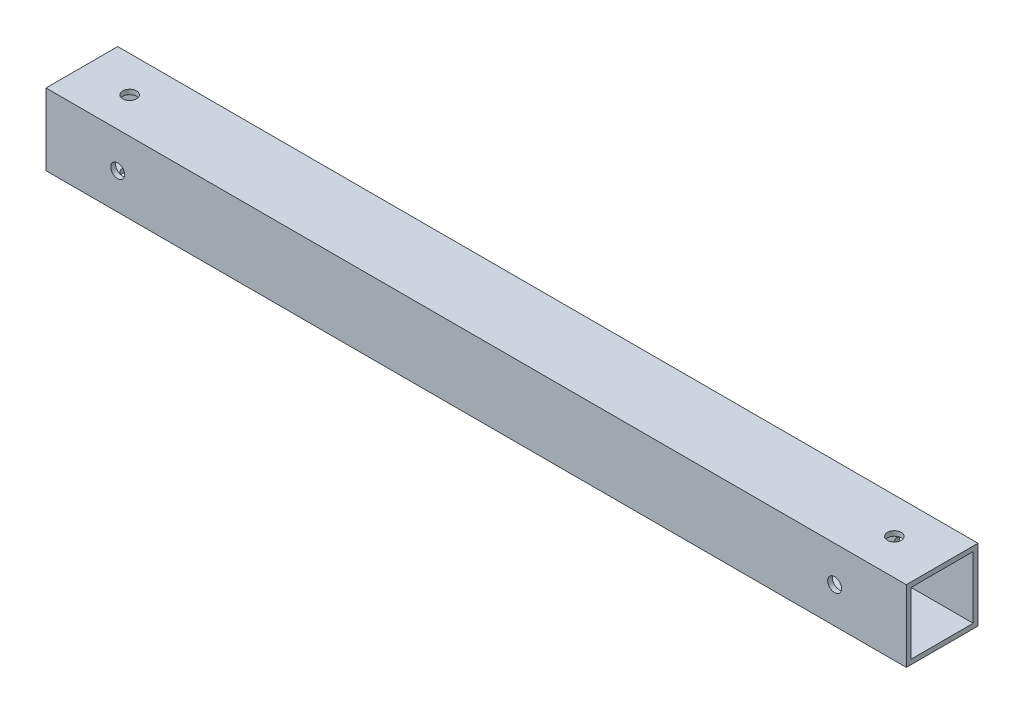
from build123d import *

# Parameters (mm, degrees)
SKETCH_1_W          = 15
SKETCH_1_H          = 15
SKETCH_1_W_2        = 13
SKETCH_1_H_2        = 13
EXTRUDE_1_DEPTH     = 180
SKETCH_2_R          = 1.45
CUT_EXTRUDE_1_DEPTH = 181.779561898
SKETCH_3_R          = 1.45
CUT_EXTRUDE_2_DEPTH = 181.779561898


with BuildPart() as part:
    # 草图1 → 凸台-拉伸1 (new body)
    with BuildSketch(Plane(origin=(0, 0, 0), x_dir=(0, 0, -1), z_dir=(1, 0, 0))):
        Rectangle(SKETCH_1_W, SKETCH_1_H)
        Rectangle(SKETCH_1_W_2, SKETCH_1_H_2, mode=Mode.SUBTRACT)
    extrude(amount=EXTRUDE_1_DEPTH)

    # 草图2 → 切除-拉伸1 (cut, through all)
    with BuildSketch(Plane(origin=(0, 7.5, 0), x_dir=(1, 0, 0), z_dir=(0, 1, 0))):
        with Locations(Location((10, 0, 0), (0, 0, 270))):
            Circle(SKETCH_2_R)
        with Locations(Location((170, 0, 0), (0, 0, 270))):
            Circle(SKETCH_2_R)
    extrude(amount=-CUT_EXTRUDE_1_DEPTH, mode=Mode.SUBTRACT)

    # 草图3 → 切除-拉伸2 (cut, through all)
    with BuildSketch(Plane.XY.offset(7.5)):
        with Locations((15, 0)):
            Circle(SKETCH_3_R)
        with Locations((165, 0)):
            Circle(SKETCH_3_R)
    extrude(amount=-CUT_EXTRUDE_2_DEPTH, mode=Mode.SUBTRACT)


solid = part.part
